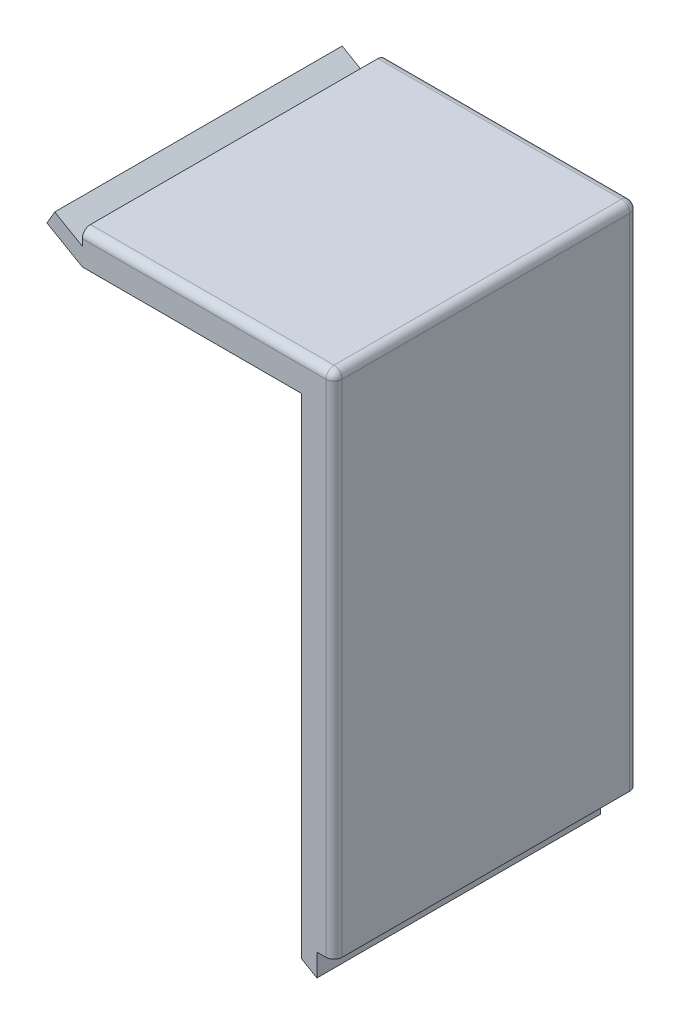
from build123d import *

# Parameters (mm, degrees)
EXTRUDE_1_DEPTH     = 10
EXTRUDE_2_DEPTH     = 64.5
SKETCH_4_W          = 3.8
SKETCH_4_H          = 69.5
EXTRUDE_4_DEPTH     = 1
EXTRUDE_5_DEPTH     = 69.5
EXTRUDE_6_DEPTH     = 70.5
FILLET_1_R          = 2
SKETCH_7_W          = 70.5
SKETCH_7_H          = 3.8
EXTRUDE_7_DEPTH     = 6
CUT_EXTRUDE_1_REACH = 185.071


with BuildPart() as part:
    # 草圖1 → 填料-伸長1 (new body)
    with BuildSketch(Plane.XY):
        Polygon((116.20678675, 119.962196633), (116.20678675, -4.797282637), (104.20678675, -4.797282637), (104.20678675, -5.797282637), (69.565770598, 14.202717363), (54.456814697, 40.372196633), (54.456814697, 119.962196633), align=None)
        Polygon((54.456814697, 40.372196633), (46.554726499, 40.372196633), (65.614726499, 7.35930824), (69.565770598, 14.202717363), align=None)
    extrude(amount=EXTRUDE_1_DEPTH)

    # 草圖2 → 填料-伸長2 (add)
    with BuildSketch(Plane.XY.offset(10)):
        Polygon((108.20678675, -4.797282637), (116.20678675, -4.797282637), (116.20678675, 119.962196633), (54.456814697, 119.962196633), (54.456814697, 111.962196633), (108.20678675, 111.962196633), align=None)
    extrude(amount=EXTRUDE_2_DEPTH)

    # 草圖4 → 填料-伸長4 (add)
    with BuildSketch(Plane.XZ.offset(4.797282637)):
        with Locations((110.10678675, 39.75)):
            Rectangle(SKETCH_4_W, SKETCH_4_H)
    extrude(amount=EXTRUDE_4_DEPTH)

    # 草圖5 → 填料-伸長5 (add)
    with BuildSketch(Plane(origin=(0, 0, 5), x_dir=(-1, 0, 0), z_dir=(0, 0, -1))):
        Polygon((-108.20678675, -5.797282637), (-108.20678675, -8.106683714), (-112.00678675, -10.300614737), (-112.00678675, -5.797282637), align=None)
    extrude(amount=-EXTRUDE_5_DEPTH)

    # 草圖6 → 填料-伸長6 (add)
    with BuildSketch(Plane.XY.offset(74.5)):
        Polygon((50.992713082, 113.962196633), (54.456814697, 111.962196633), (54.456814697, 116.350058678), (52.892713082, 117.253093167), align=None)
    extrude(amount=-EXTRUDE_6_DEPTH)

    # 圓角1
    fillet_1_edges = [part.edges().sort_by_distance(p)[0] for p in [
        (85.331800723, 119.962196633, 0),
        (116.20678675, 57.582456998, 0),
        (116.20678675, 119.962196633, 37.25),
        (116.20678675, 57.582456998, 74.5),
        (85.331800723, 119.962196633, 74.5),
    ]]
    fillet(fillet_1_edges, radius=FILLET_1_R)

    # 草圖7 → 填料-伸長7 (add)
    with BuildSketch(Plane(origin=(-11.102543866, 6.41005669, 0), x_dir=(0, 0, 1), z_dir=(-0.8660254037844396, 0.4999999999999985, 0))):
        with Locations((39.25, 126.090513896)):
            Rectangle(SKETCH_7_W, SKETCH_7_H)
    extrude(amount=EXTRUDE_7_DEPTH)

    # 草圖8 → 除料-伸長1 (cut, up to next)
    with BuildSketch(Plane(origin=(0, 0, 0), x_dir=(-1, 0, 0), z_dir=(0, 0, -1)), mode=Mode.PRIVATE) as cut_extrude_1_sk1:
        Polygon((-104.20678675, -4.797282637), (-102.474735942, -4.797282637), (-104.20678675, -5.797282637), align=None)
    cut_extrude_1_tool1 = extrude(cut_extrude_1_sk1.sketch, amount=-CUT_EXTRUDE_1_REACH, mode=Mode.PRIVATE) & part.part
    add(cut_extrude_1_tool1.solids().sort_by_distance((103.629436, -5.130616, 0))[0], mode=Mode.SUBTRACT)


solid = part.part
